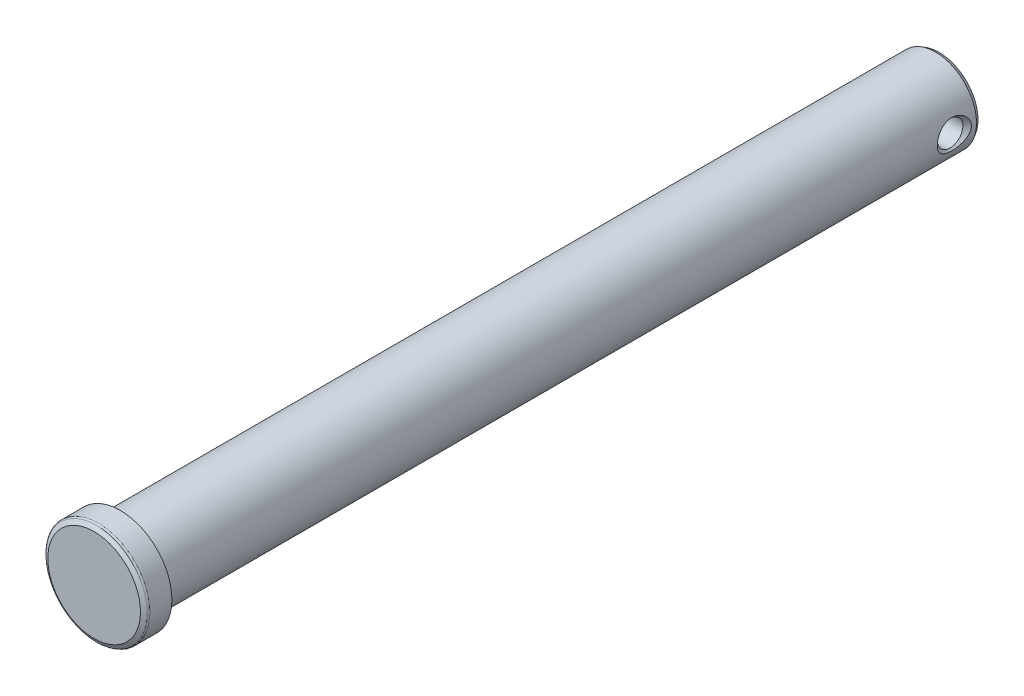
from build123d import *

# Parameters (mm, degrees)
CUT_EXTRUDE1_DEPTH      = 69.504934844
CUT_EXTRUDE1_DEPTH_BACK = 69.504934844
SKETCH3_R               = 1.9812
FILLET1_R               = 0.3175


with BuildPart() as part:
    # Sketch2 → Revolve1 (revolve)
    with BuildSketch(Plane(origin=(0, 0, 0), x_dir=(0, 0, -1), z_dir=(1, 0, 0)), mode=Mode.PRIVATE) as revolve1_sk:
        Polygon((63.5, 6.0325), (63.5, 0), (-67.564, 0), (-67.564, 7.1882), (-67.094729701, 8.001), (-63.5, 8.001), (-63.5, 6.35), (62.950073869, 6.35), align=None)
    revolve(revolve1_sk.sketch.rotate(Axis((0, 0, 63.5), (0, 0, -1)), 90), axis=Axis((0, 0, 63.5), (0, 0, -1)))

    # Sketch3 → Cut-Extrude1 (cut, two sides: drawn at the far end of the back side and taken through both)
    with BuildSketch(Plane(origin=(0, 0, 0), x_dir=(0, 0, -1), z_dir=(1, 0, 0)).offset(-CUT_EXTRUDE1_DEPTH_BACK)):
        with Locations((59.5122, 0)):
            Circle(SKETCH3_R)
    extrude(amount=CUT_EXTRUDE1_DEPTH + CUT_EXTRUDE1_DEPTH_BACK, mode=Mode.SUBTRACT)

    # Fillet1
    fillet1_edges = [part.edges().sort_by_distance(p)[0] for p in [
        (-8.001, 0, 67.094729701),
        (-6.35, 0, 63.5),
    ]]
    fillet(fillet1_edges, radius=FILLET1_R)

    # Sketch4 → Cut-Revolve1 (revolve, cut)
    with BuildSketch(Plane(origin=(0, 0, 0), x_dir=(1, 0, 0), z_dir=(0, 1, 0)), mode=Mode.PRIVATE) as cut_revolve1_sk:
        Polygon((6.35, 59.5122), (6.35, 56.8706), (3.7084, 59.5122), align=None)
        Polygon((-6.35, 56.8706), (-3.7084, 59.5122), (-6.35, 59.5122), align=None)
    revolve(cut_revolve1_sk.sketch.rotate(Axis((6.35, 0, -59.5122), (-1, 0, 0)), 180), axis=Axis((6.35, 0, -59.5122), (-1, 0, 0)), mode=Mode.SUBTRACT)


solid = part.part
